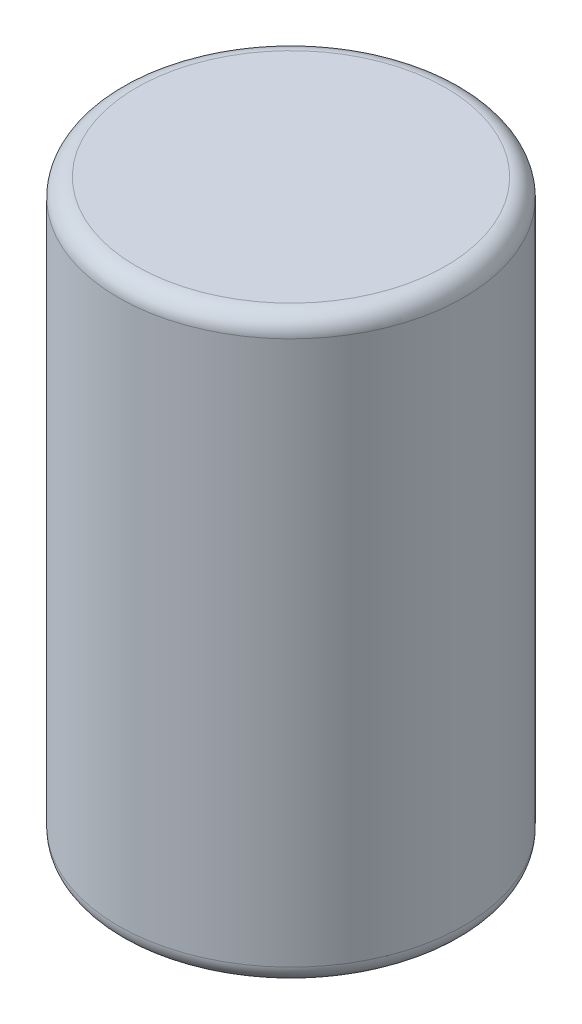
from build123d import *

# Parameters (mm, degrees)
SKETCH1_R           = 4.7625
BOSS_EXTRUDE1_DEPTH = 16
FILLET2_R           = 0.5
FILLET3_R           = 0.5


with BuildPart() as part:
    # Sketch1 → Boss-Extrude1 (new body)
    with BuildSketch(Plane(origin=(0, 0, 0), x_dir=(1, 0, 0), z_dir=(0, 1, 0))):
        with Locations(Location((0, 0, 0), (0, 0, 270))):
            Circle(SKETCH1_R)
    extrude(amount=BOSS_EXTRUDE1_DEPTH)

    # Fillet2
    fillet2_edges = [part.edges().sort_by_distance(p)[0] for p in [
        (0, 16, -4.7625),
    ]]
    fillet(fillet2_edges, radius=FILLET2_R)

    # Fillet3
    fillet3_edges = [part.edges().sort_by_distance(p)[0] for p in [
        (0, 0, -4.7625),
    ]]
    fillet(fillet3_edges, radius=FILLET3_R)


solid = part.part
